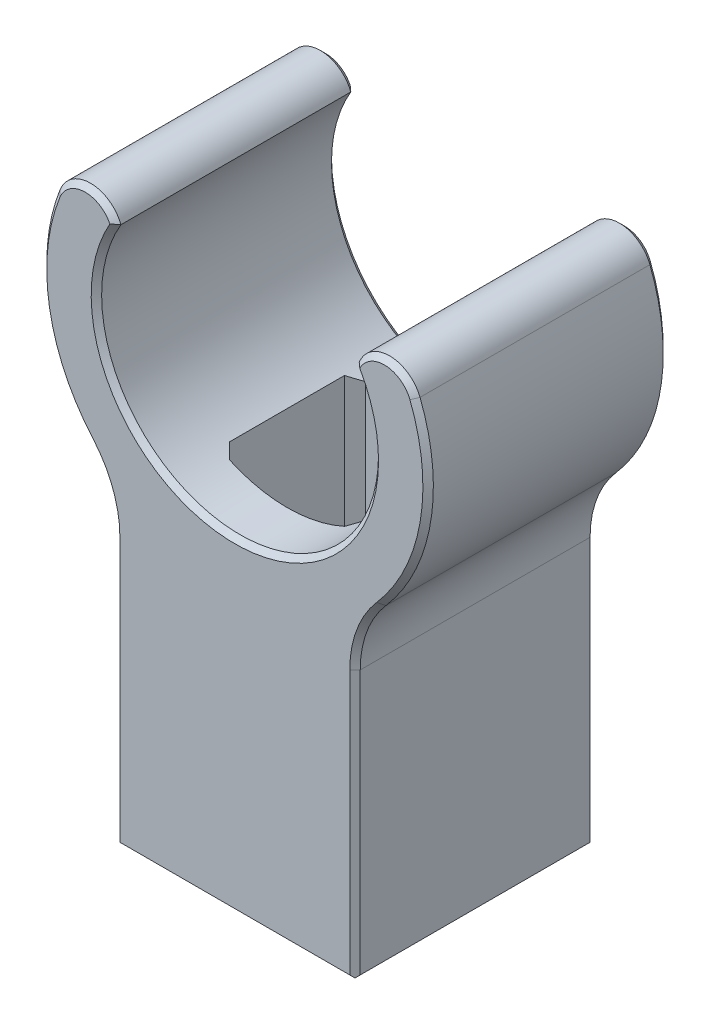
from build123d import *

# Parameters (mm, degrees)
BOSS_EXTRUDE1_DEPTH     = 23
FILLET1_R               = 10
CHAMFER1_SIZE           = 0.5
CUT_EXTRUDE1_REACH      = 62.864
CUT_EXTRUDE1_END_RADIUS = 13.25
SKETCH2_W               = 13
SKETCH2_H               = 13
CHAMFER2_SIZE           = 1
CHAMFER3_SIZE           = 0.5


with BuildPart() as part:
    # Sketch1 → Boss-Extrude1 (new body)
    with BuildSketch(Plane.XY):
        with BuildLine():
            Line((-11.5, -14.491376746), (-11.5, -44.491376746))
            Line((-11.5, -44.491376746), (11.5, -44.491376746))
            Line((11.5, -44.491376746), (11.5, -14.491376746))
            ThreePointArc((11.5, -14.491376746), (17.862669336, -4.814046549), (17.224619009, 6.75))
            ThreePointArc((17.224619009, 6.75), (14.31318663, 8.736071822), (11.401754251, 6.75))
            ThreePointArc((11.401754251, 6.75), (0, -13.25), (-11.401754251, 6.75))
            ThreePointArc((-11.401754251, 6.75), (-14.31318663, 8.736071822), (-17.224619009, 6.75))
            ThreePointArc((-17.224619009, 6.75), (-17.862669336, -4.814046549), (-11.5, -14.491376746))
        make_face()
    extrude(amount=BOSS_EXTRUDE1_DEPTH)

    # Fillet1
    fillet1_edges = [part.edges().sort_by_distance(p)[0] for p in [
        (-11.5, -14.491376746, 11.5),
        (11.5, -14.491376746, 11.5),
    ]]
    fillet(fillet1_edges, radius=FILLET1_R)

    # Chamfer1
    chamfer1_edges = [part.edges().sort_by_distance(p)[0] for p in [
        (0, -13.25, 0),
        (14.31318663, 8.736071822, 0),
        (11.5, -31.59983184, 0),
        (14.31318663, 8.736071822, 23),
        (0, -13.25, 23),
        (-14.31318663, 8.736071822, 23),
        (-18.229248977, -3.153487233, 23),
        (-11.5, -31.59983184, 0),
        (-11.5, -31.59983184, 23),
        (18.229248977, -3.153487233, 0),
        (18.229248977, -3.153487233, 23),
        (-12.134141884, -15.203903714, 0),
        (-12.134141884, -15.203903714, 23),
        (12.134141884, -15.203903714, 0),
        (12.134141884, -15.203903714, 23),
        (0, -44.491376746, 23),
        (11.5, -31.59983184, 23),
        (0, -44.491376746, 0),
        (-18.229248977, -3.153487233, 0),
        (-14.31318663, 8.736071822, 0),
    ]]
    chamfer(chamfer1_edges, length=CHAMFER1_SIZE)

    # Cut-Extrude1: up to this cylinder (the profile starts outside it)
    cut_extrude1_end = Plane(origin=(0, 0, 11.5), z_dir=(0, 0, -1)) * Cylinder(CUT_EXTRUDE1_END_RADIUS, 153.228, mode=Mode.PRIVATE)
    # Sketch2 → Cut-Extrude1 (cut, up to the surface)
    with BuildSketch(Plane.XZ.offset(44.491376746), mode=Mode.PRIVATE) as cut_extrude1_sk1:
        with Locations((0, 11.5)):
            Rectangle(SKETCH2_W, SKETCH2_H)
    cut_extrude1_tool1 = extrude(cut_extrude1_sk1.sketch, amount=-CUT_EXTRUDE1_REACH, mode=Mode.PRIVATE) - cut_extrude1_end
    add(cut_extrude1_tool1.solids().sort_by_distance((0, -44.491377, 11.5))[0], mode=Mode.SUBTRACT)

    # Chamfer2
    chamfer2_edges = [part.edges().sort_by_distance(p)[0] for p in [
        (-6.5, -28.018739992, 5),
        (-6.5, -28.018739992, 18),
        (6.5, -28.018739992, 18),
        (6.5, -28.018739992, 5),
    ]]
    chamfer(chamfer2_edges, length=CHAMFER2_SIZE)

    # Chamfer3
    chamfer3_edges = [part.edges().sort_by_distance(p)[0] for p in [
        (0, -44.491376746, 5),
        (-6.5, -44.491376746, 11.5),
        (6.5, -44.491376746, 11.5),
        (0, -44.491376746, 18),
        (-6, -44.491376746, 5.5),
        (6, -44.491376746, 5.5),
        (6, -44.491376746, 17.5),
        (-6, -44.491376746, 17.5),
        (-11.5, -44.491376746, 11.5),
        (11.5, -44.491376746, 11.5),
    ]]
    chamfer(chamfer3_edges, length=CHAMFER3_SIZE)


solid = part.part
